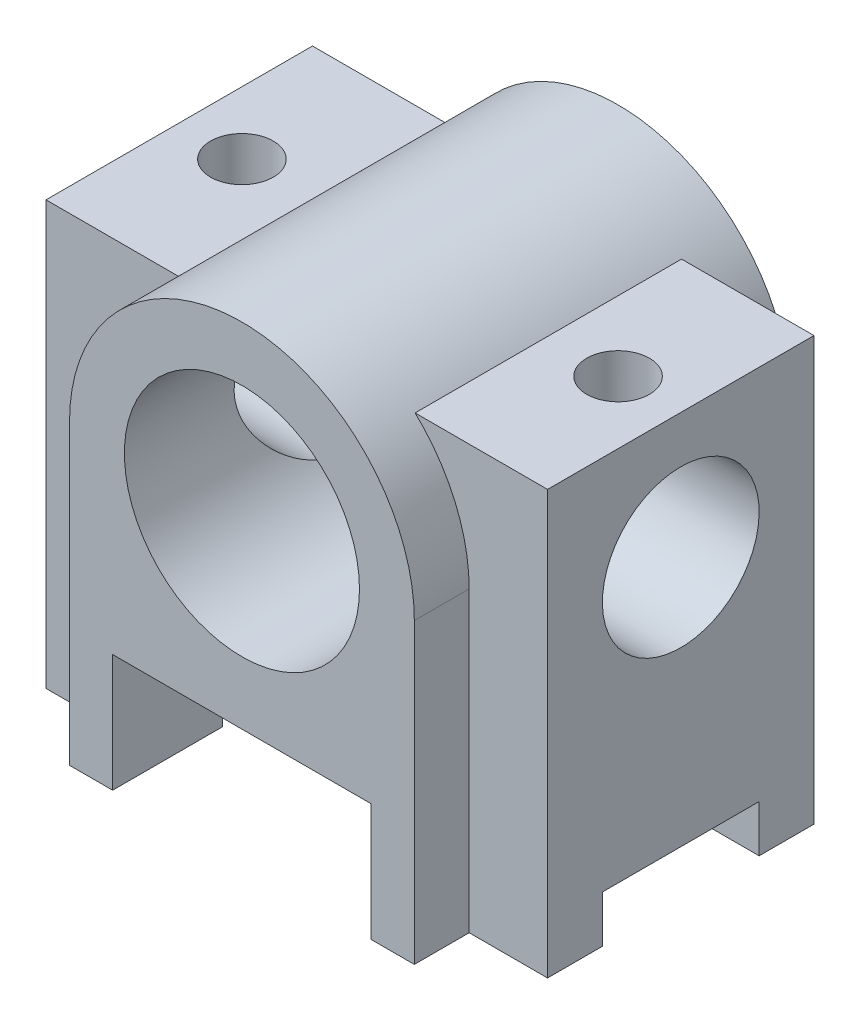
from build123d import *
from build123d.topology import SkipClean

# Parameters (mm, degrees)
SKETCH1_R           = 15
BOSS_EXTRUDE1_DEPTH = 48
BOSS_EXTRUDE3_DEPTH = 6.9
BOSS_EXTRUDE4_START = 10
BOSS_EXTRUDE4_DEPTH = 10
SKETCH2_5_W         = 20
SKETCH2_5_H         = 6
CUT_EXTRUDE1_DEPTH  = 82.633326528
SKETCH3_R           = 4
CUT_EXTRUDE2_DEPTH  = 10


with BuildPart() as part:
    # Sketch1 → Boss-Extrude1 (new body)
    with BuildSketch(Plane.XY):
        with BuildLine():
            Line((-22, 0), (-22, -37.999983616))
            Line((-22, -37.999983616), (-16.5, -37.999983616))
            Line((-16.5, -37.999983616), (-16.5, -23))
            Line((-16.5, -23), (16.5, -23))
            Line((16.5, -23), (16.5, -38))
            Line((16.5, -38), (22, -38))
            Line((22, -38), (22, 0))
            ThreePointArc((22, 0), (0, 22), (-22, 0))
        make_face()
        Circle(SKETCH1_R, mode=Mode.SUBTRACT)
    boss_extrude1 = extrude(amount=-BOSS_EXTRUDE1_DEPTH)

    # Sketch2 → Boss-Extrude3 (add)
    with BuildSketch(Plane(origin=(22, 0, 0), x_dir=(0, 0, -1), z_dir=(1, 0, 0))):
        with BuildLine():
            Line((7, 16), (7, 0))
            Line((7, 0), (14, 0))
            ThreePointArc((14, 0), (16.928932188, 7.071067812), (24, 10))
            Line((24, 10), (24, 16))
            Line((24, 16), (7, 16))
        make_face()
        with BuildLine():
            Line((41, 16), (24, 16))
            Line((24, 16), (24, 10))
            ThreePointArc((24, 10), (31.071067812, 7.071067812), (34, 0))
            Line((34, 0), (41, 0))
            Line((41, 0), (41, 16))
        make_face()
    boss_extrude3 = extrude(amount=-BOSS_EXTRUDE3_DEPTH)

    # Sketch2<4> → Boss-Extrude4 (add)
    with BuildSketch(Plane(origin=(22, 0, 0), x_dir=(0, 0, -1), z_dir=(1, 0, 0)).offset(BOSS_EXTRUDE4_START)):
        with BuildLine():
            Line((41, 16), (24, 16))
            Line((24, 16), (24, 10))
            ThreePointArc((24, 10), (31.071067812, 7.071067812), (34, 0))
            Line((34, 0), (41, 0))
            Line((41, 0), (41, 16))
        make_face()
        with BuildLine():
            Line((7, 16), (7, 0))
            Line((7, 0), (14, 0))
            ThreePointArc((14, 0), (16.928932188, 7.071067812), (24, 10))
            Line((24, 10), (24, 16))
            Line((24, 16), (7, 16))
        make_face()
        with BuildLine():
            Line((7, 0), (7, -38))
            Line((7, -38), (14, -38))
            Line((14, -38), (14, -32))
            Line((14, -32), (24, -32))
            Line((24, -32), (24, -10))
            ThreePointArc((24, -10), (16.928932188, -7.071067812), (14, 0))
            Line((14, 0), (7, 0))
        make_face()
        with BuildLine():
            Line((34, -32), (34, -38))
            Line((34, -38), (41, -38))
            Line((41, -38), (41, 0))
            Line((41, 0), (34, 0))
            ThreePointArc((34, 0), (31.071067812, -7.071067812), (24, -10))
            Line((24, -10), (24, -32))
            Line((24, -32), (34, -32))
        make_face()
    boss_extrude4 = extrude(amount=-BOSS_EXTRUDE4_DEPTH)

    # Mirror2: Boss-Extrude1, Boss-Extrude3, Boss-Extrude4 across plane
    add(boss_extrude1.mirror(Plane.ZY))
    add(boss_extrude3.mirror(Plane.ZY))
    add(boss_extrude4.mirror(Plane.ZY))

    # Sketch2<5> → Cut-Extrude1 (cut, through all)
    with SkipClean():  # the faces are left unmerged after this step: merging them gives an invalid solid
        with BuildSketch(Plane(origin=(22, 0, 0), x_dir=(0, 0, -1), z_dir=(1, 0, 0))):
            with BuildLine():
                Line((24, 0), (14, 0))
                ThreePointArc((14, 0), (16.928932188, -7.071067812), (24, -10))
                Line((24, -10), (24, 0))
            make_face()
            with BuildLine():
                ThreePointArc((24, 10), (16.928932188, 7.071067812), (14, 0))
                Line((14, 0), (24, 0))
                Line((24, 0), (24, 10))
            make_face()
            with BuildLine():
                ThreePointArc((34, 0), (31.071067812, 7.071067812), (24, 10))
                Line((24, 10), (24, 0))
                Line((24, 0), (34, 0))
            make_face()
            with BuildLine():
                Line((24, 0), (24, -10))
                ThreePointArc((24, -10), (31.071067812, -7.071067812), (34, 0))
                Line((34, 0), (24, 0))
            make_face()
            with Locations((24, -35)):
                Rectangle(SKETCH2_5_W, SKETCH2_5_H)
        extrude(amount=-CUT_EXTRUDE1_DEPTH, mode=Mode.SUBTRACT)

    # Sketch3 → Cut-Extrude2 (cut)
    with SkipClean():  # the faces are left unmerged after this step: merging them gives an invalid solid
        with BuildSketch(Plane(origin=(0, 16, 0), x_dir=(1, 0, 0), z_dir=(0, 1, 0))):
            with Locations(Location((24, 24, 0), (0, 0, 180))):
                Circle(SKETCH3_R)
            with Locations(Location((-24, 24, 0), (0, 0, 180))):
                Circle(SKETCH3_R)
        extrude(amount=-CUT_EXTRUDE2_DEPTH, mode=Mode.SUBTRACT)


solid = part.part
